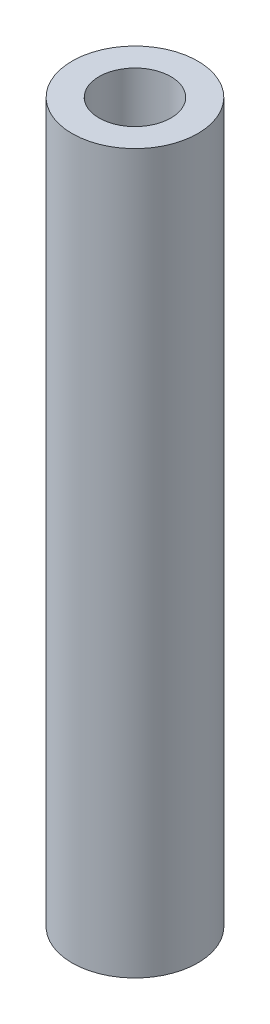
from build123d import *

# Parameters (mm, degrees)
SKETCH1_R           = 4.445
SKETCH1_R_2         = 2.54
BOSS_EXTRUDE1_DEPTH = 50.8


with BuildPart() as part:
    # Sketch1 → Boss-Extrude1 (new body)
    with BuildSketch(Plane(origin=(0, 0, 0), x_dir=(1, 0, 0), z_dir=(0, 1, 0))):
        Circle(SKETCH1_R)
        Circle(SKETCH1_R_2, mode=Mode.SUBTRACT)
    extrude(amount=BOSS_EXTRUDE1_DEPTH)


solid = part.part
